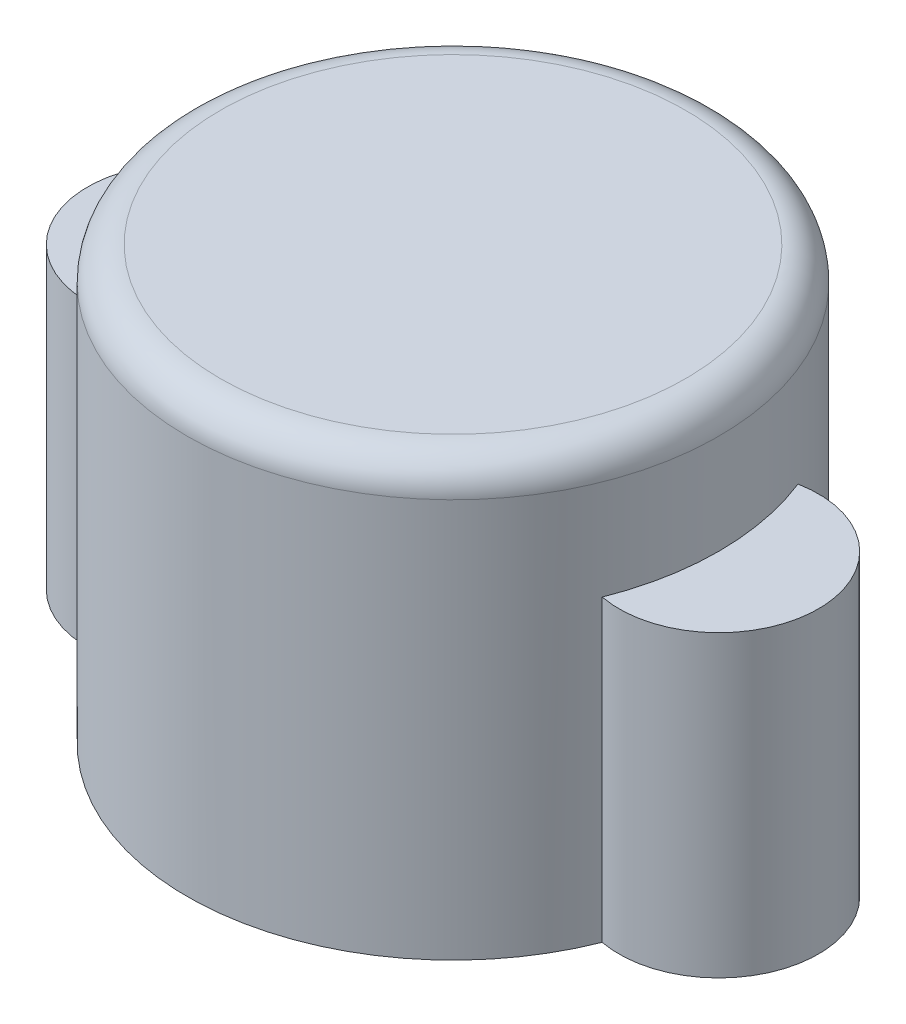
from build123d import *

# Parameters (mm, degrees)
SKETCH1_R           = 3
SKETCH1_R_2         = 8
BOSS_EXTRUDE1_DEPTH = 9
SKETCH2_R           = 8
BOSS_EXTRUDE2_DEPTH = 4
FILLET1_R           = 1


with BuildPart() as part:
    # Sketch1 → Boss-Extrude1 (new body)
    with BuildSketch(Plane(origin=(0, 0, 0), x_dir=(1, 0, 0), z_dir=(0, 1, 0))):
        with Locations((-8, 0)):
            Circle(SKETCH1_R)
        Circle(SKETCH1_R_2)
        with Locations((8, 0)):
            Circle(SKETCH1_R)
    extrude(amount=BOSS_EXTRUDE1_DEPTH)

    # Sketch2 → Boss-Extrude2 (add)
    with BuildSketch(Plane(origin=(0, 9, 0), x_dir=(1, 0, 0), z_dir=(0, 1, 0))):
        with Locations(Location((0, 0, 0), (0, 0, 158.38615425))):
            Circle(SKETCH2_R)
    extrude(amount=BOSS_EXTRUDE2_DEPTH)

    # Fillet1
    fillet1_edges = [part.edges().sort_by_distance(p)[0] for p in [
        (7.4375, 13, 2.946793809),
    ]]
    fillet(fillet1_edges, radius=FILLET1_R)


solid = part.part
